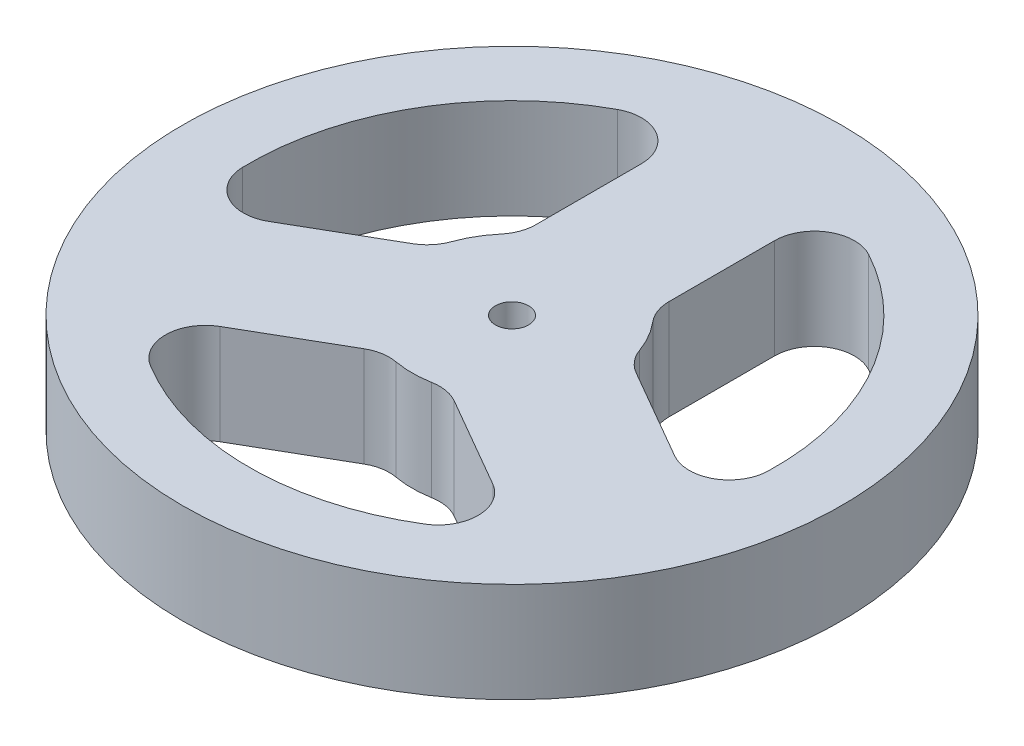
from build123d import *

# Parameters (mm, degrees)
SZKIC1_R                    = 49.5
SZKIC1_R_2                  = 39.5
SZKIC1_R_3                  = 15
SZKIC1_R_4                  = 2.5
DODANIE_WYCI_GNI_CIE1_DEPTH = 15
ZAOKR_GLENIE1_R             = 6


with BuildPart() as part:
    # Szkic1 → Dodanie-wyciągnięcie1 (new body)
    # profile 1 of 6: a face of its own
    with BuildSketch(Plane(origin=(0, 0, 0), x_dir=(1, 0, 0), z_dir=(0, 1, 0))):
        with Locations(Location((0, 0, 0), (0, 0, 270))):
            Circle(SZKIC1_R)
        Circle(SZKIC1_R_2, mode=Mode.SUBTRACT)
    # profile 2 of 6: a face of its own
    with BuildSketch(Plane(origin=(0, 0, 0), x_dir=(1, 0, 0), z_dir=(0, 1, 0))):
        with BuildLine():
            ThreePointArc((-10, 11.180339887), (-5.352331347, 14.012585384), (0, 15))
            Line((0, 15), (0, 39.5))
            ThreePointArc((0, 39.5), (-5.041225271, 39.176983648), (-10, 38.213217609))
            Line((-10, 38.213217609), (-10, 11.180339887))
        make_face()
    # profile 3 of 6: a face of its own
    with BuildSketch(Plane(origin=(0, 0, 0), x_dir=(1, 0, 0), z_dir=(0, 1, 0))):
        with BuildLine():
            Line((0, 39.5), (0, 15))
            ThreePointArc((0, 15), (5.352331347, 14.012585384), (10, 11.180339887))
            Line((10, 11.180339887), (10, 38.213217609))
            ThreePointArc((10, 38.213217609), (5.041225271, 39.176983648), (0, 39.5))
        make_face()
    # profile 4 of 6: a face of its own
    with BuildSketch(Plane(origin=(0, 0, 0), x_dir=(1, 0, 0), z_dir=(0, 1, 0))):
        with BuildLine():
            Line((38.093617209, -10.446354766), (14.682458366, 3.070084094))
            ThreePointArc((14.682458366, 3.070084094), (14.920403404, 1.54323111), (15, 0))
            ThreePointArc((15, 0), (12.149832828, -8.796679047), (4.682458366, -14.250423982))
            Line((4.682458366, -14.250423982), (28.093617209, -27.766862842))
            ThreePointArc((28.093617209, -27.766862842), (34.208003449, -19.75), (38.093617209, -10.446354766))
        make_face()
    # profile 5 of 6: a face of its own
    with BuildSketch(Plane(origin=(0, 0, 0), x_dir=(1, 0, 0), z_dir=(0, 1, 0))):
        Circle(SZKIC1_R_3)
        with Locations(Location((0, 0, 0), (0, 0, 270))):
            Circle(SZKIC1_R_4, mode=Mode.SUBTRACT)
    # profile 6 of 6: a face of its own
    with BuildSketch(Plane(origin=(0, 0, 0), x_dir=(1, 0, 0), z_dir=(0, 1, 0))):
        with BuildLine():
            ThreePointArc((-4.682458366, -14.250423982), (-12.990381057, -7.5), (-14.682458366, 3.070084094))
            Line((-14.682458366, 3.070084094), (-38.093617209, -10.446354766))
            ThreePointArc((-38.093617209, -10.446354766), (-34.208003449, -19.75), (-28.093617209, -27.766862842))
            Line((-28.093617209, -27.766862842), (-4.682458366, -14.250423982))
        make_face()
    extrude(amount=DODANIE_WYCI_GNI_CIE1_DEPTH)

    # Zaokrąglenie1
    zaokr_glenie1_edges = [part.edges().sort_by_distance(p)[0] for p in [
        (14.682458366, 7.5, -3.070084094),
        (38.093617209, 7.5, 10.446354766),
        (10, 7.5, -38.213217609),
        (10, 7.5, -11.180339887),
        (-10, 7.5, -38.213217609),
        (-38.093617209, 7.5, 10.446354766),
        (-14.682458366, 7.5, -3.070084094),
        (-10, 7.5, -11.180339887),
        (-28.093617209, 7.5, 27.766862842),
        (28.093617209, 7.5, 27.766862842),
        (4.682458366, 7.5, 14.250423982),
        (-4.682458366, 7.5, 14.250423982),
    ]]
    fillet(zaokr_glenie1_edges, radius=ZAOKR_GLENIE1_R)


solid = part.part
